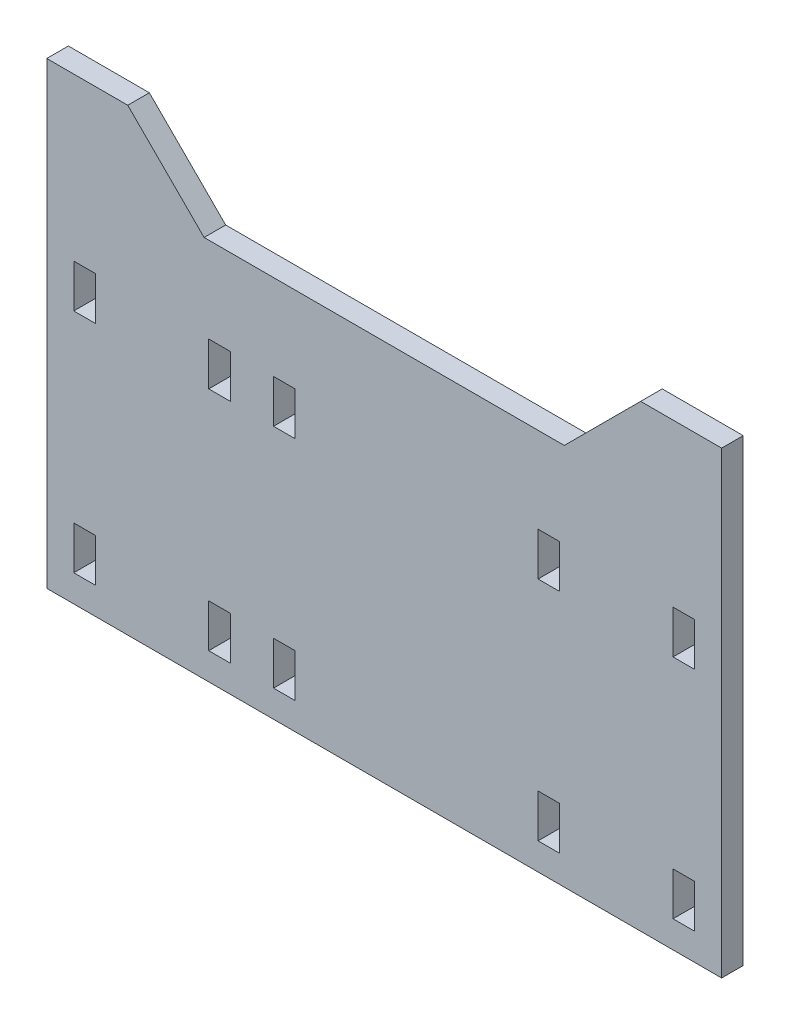
from build123d import *

# Parameters (mm, degrees)
SKETCH1_W           = 125
SKETCH1_H           = 60
SKETCH1_W_2         = 4
SKETCH1_H_2         = 8
BOSS_EXTRUDE1_DEPTH = 4
BOSS_EXTRUDE2_DEPTH = 4


with BuildPart() as part:
    # Sketch1 → Boss-Extrude1 (new body)
    with BuildSketch(Plane.XY):
        with Locations((-6, 0)):
            Rectangle(SKETCH1_W, SKETCH1_H)
        with Locations((-36.5, 21)):
            Rectangle(SKETCH1_W_2, SKETCH1_H_2, mode=Mode.SUBTRACT)
        with Locations((24.5, 21)):
            Rectangle(SKETCH1_W_2, SKETCH1_H_2, mode=Mode.SUBTRACT)
        with Locations((24.5, -21)):
            Rectangle(SKETCH1_W_2, SKETCH1_H_2, mode=Mode.SUBTRACT)
        with Locations((-24.5, 21)):
            Rectangle(SKETCH1_W_2, SKETCH1_H_2, mode=Mode.SUBTRACT)
        with Locations((-24.5, -21)):
            Rectangle(SKETCH1_W_2, SKETCH1_H_2, mode=Mode.SUBTRACT)
        with Locations((49.5, 21)):
            Rectangle(SKETCH1_W_2, SKETCH1_H_2, mode=Mode.SUBTRACT)
        with Locations((49.5, -21)):
            Rectangle(SKETCH1_W_2, SKETCH1_H_2, mode=Mode.SUBTRACT)
        with Locations((-36.5, -21)):
            Rectangle(SKETCH1_W_2, SKETCH1_H_2, mode=Mode.SUBTRACT)
        with Locations((-61.5, 21)):
            Rectangle(SKETCH1_W_2, SKETCH1_H_2, mode=Mode.SUBTRACT)
        with Locations((-61.5, -21)):
            Rectangle(SKETCH1_W_2, SKETCH1_H_2, mode=Mode.SUBTRACT)
    extrude(amount=BOSS_EXTRUDE1_DEPTH)

    # Sketch2 → Boss-Extrude2 (add)
    with BuildSketch(Plane.XY):
        Polygon((-68.5, 30), (-68.5, 55), (-53.5, 55), (-39.357864376, 40.857864376), (27.357864376, 40.857864376), (41.5, 55), (56.5, 55), (56.5, 30), align=None)
    extrude(amount=BOSS_EXTRUDE2_DEPTH)


solid = part.part
